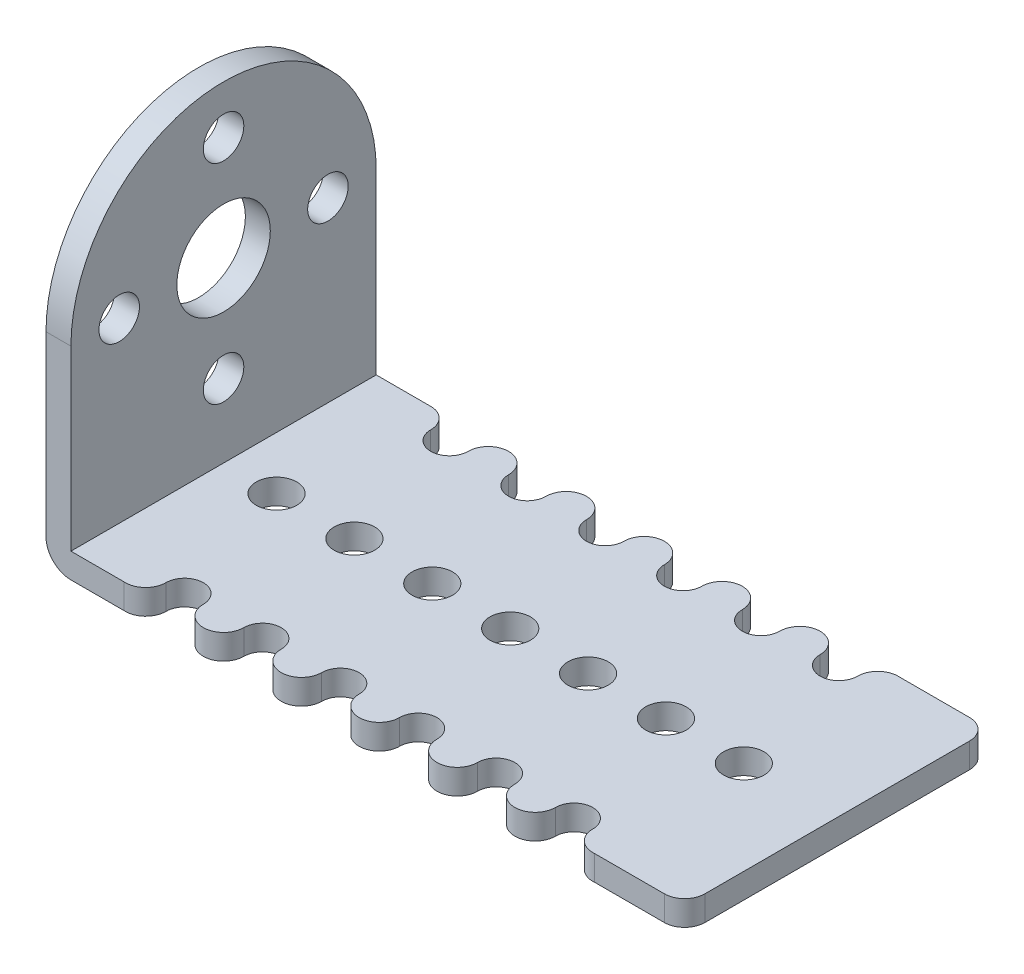
from build123d import *

# Parameters (mm, degrees)
BOSS_EXTRUDE1_DEPTH      = 2.032
SKETCH2_W                = 24.892
SKETCH2_H                = 2.032
BOSS_EXTRUDE2_DEPTH      = 7.366000072
SKETCH3_W                = 24.892
SKETCH3_H                = 2.032
BOSS_EXTRUDE3_DEPTH      = 4.318000079
BOSS_EXTRUDE4_DEPTH      = 2.032
M7_CLEARANCE_HOLE1_D     = 7.62
M3_CLEARANCE_HOLE1_D     = 3.302
M3_CLEARANCE_HOLE2_D     = 3.302
M3_CLEARANCE_HOLE2_DEPTH = 28.956
FILLET1_R                = 1.655535703
FILLET2_R                = 2.032


with BuildPart() as part:
    # Sketch1 → Boss-Extrude1 (new body)
    with BuildSketch(Plane.XZ):
        with BuildLine():
            Line((44.703999934, -12.446), (44.703999934, 12.446))
            ThreePointArc((44.703999934, 12.446), (43.455024595, 12.008165774), (42.926000003, 10.795000003))
            ThreePointArc((42.926000003, 10.795000003), (41.402000003, 9.271000003), (39.878000003, 10.795000003))
            ThreePointArc((39.878000003, 10.795000003), (38.227000003, 12.446000003), (36.576000003, 10.795000003))
            ThreePointArc((36.576000003, 10.795000003), (35.052000003, 9.271000003), (33.528000003, 10.795000003))
            ThreePointArc((33.528000003, 10.795000003), (31.877000003, 12.446000003), (30.226000003, 10.795000003))
            ThreePointArc((30.226000003, 10.795000003), (28.702000003, 9.271000003), (27.178000003, 10.795000003))
            ThreePointArc((27.178000003, 10.795000003), (25.527000003, 12.446000003), (23.876000003, 10.795000003))
            ThreePointArc((23.876000003, 10.795000003), (22.352000003, 9.271000003), (20.828000003, 10.795000003))
            ThreePointArc((20.828000003, 10.795000003), (19.177000003, 12.446000003), (17.526000003, 10.795000003))
            ThreePointArc((17.526000003, 10.795000003), (16.002000003, 9.271000003), (14.478000003, 10.795000003))
            ThreePointArc((14.478000003, 10.795000003), (12.827000003, 12.446000003), (11.176000003, 10.795000003))
            ThreePointArc((11.176000003, 10.795000003), (9.652000003, 9.271000003), (8.128000003, 10.795000003))
            ThreePointArc((8.128000003, 10.795000003), (7.598975413, 12.008165771), (6.350000079, 12.446))
            Line((6.350000079, 12.446), (6.350000079, -12.446))
            ThreePointArc((6.350000079, -12.446), (7.598975413, -12.008165771), (8.128000003, -10.795000003))
            ThreePointArc((8.128000003, -10.795000003), (9.652000003, -9.271000003), (11.176000003, -10.795000003))
            ThreePointArc((11.176000003, -10.795000003), (12.827000003, -12.446000003), (14.478000003, -10.795000003))
            ThreePointArc((14.478000003, -10.795000003), (16.002000003, -9.271000003), (17.526000003, -10.795000003))
            ThreePointArc((17.526000003, -10.795000003), (19.177000003, -12.446000003), (20.828000003, -10.795000003))
            ThreePointArc((20.828000003, -10.795000003), (22.352000003, -9.271000003), (23.876000003, -10.795000003))
            ThreePointArc((23.876000003, -10.795000003), (25.527000003, -12.446000003), (27.178000003, -10.795000003))
            ThreePointArc((27.178000003, -10.795000003), (28.702000003, -9.271000003), (30.226000003, -10.795000003))
            ThreePointArc((30.226000003, -10.795000003), (31.877000003, -12.446000003), (33.528000003, -10.795000003))
            ThreePointArc((33.528000003, -10.795000003), (35.052000003, -9.271000003), (36.576000003, -10.795000003))
            ThreePointArc((36.576000003, -10.795000003), (38.227000003, -12.446000003), (39.878000003, -10.795000003))
            ThreePointArc((39.878000003, -10.795000003), (41.402000003, -9.271000003), (42.926000003, -10.795000003))
            ThreePointArc((42.926000003, -10.795000003), (43.455024595, -12.008165773), (44.703999934, -12.446))
        make_face()
    extrude(amount=-BOSS_EXTRUDE1_DEPTH)

    # Sketch2 → Boss-Extrude2 (add)
    with BuildSketch(Plane(origin=(44.703999934, 0, 0), x_dir=(0, 0, -1), z_dir=(1, 0, 0))):
        with Locations((0, 1.016)):
            Rectangle(SKETCH2_W, SKETCH2_H)
    extrude(amount=BOSS_EXTRUDE2_DEPTH)

    # Sketch3 → Boss-Extrude3 (add)
    with BuildSketch(Plane.ZY.offset(-6.350000079)):
        with Locations((0, 1.016)):
            Rectangle(SKETCH3_W, SKETCH3_H)
    extrude(amount=BOSS_EXTRUDE3_DEPTH)

    # Sketch4 → Boss-Extrude4 (add)
    with BuildSketch(Plane.ZY.offset(-2.032)):
        with BuildLine():
            Line((-12.446, 0), (-12.446, 16.51))
            ThreePointArc((-12.446, 16.51), (0, 28.956), (12.446, 16.51))
            Line((12.446, 16.51), (12.446, 0))
            Line((12.446, 0), (-12.446, 0))
        make_face()
    extrude(amount=BOSS_EXTRUDE4_DEPTH)

    # M7 Clearance Hole1 (through all)
    with Locations(Plane(origin=(2.032, 0, 0), x_dir=(0, 0, -1), z_dir=(1, 0, 0))):
        with Locations((0, 16.51)):
            Hole(M7_CLEARANCE_HOLE1_D / 2)

    # M3 Clearance Hole1 (through all)
    with Locations(Plane(origin=(2.032, 0, 0), x_dir=(0, 0, -1), z_dir=(1, 0, 0))):
        with Locations((0, 25.019), (0, 8.001), (-8.509, 16.51), (8.509, 16.51)):
            Hole(M3_CLEARANCE_HOLE1_D / 2)

    # M3 Clearance Hole2
    with Locations(Plane(origin=(0, 0, 0), x_dir=(-1, 0, 0), z_dir=(0, -1, 0))):
        with Locations((-38.1, 0), (-25.4, 0), (-12.7, 0), (-6.35, 0), (-19.05, 0), (-31.75, 0), (-44.45, 0)):
            Hole(M3_CLEARANCE_HOLE2_D / 2, depth=M3_CLEARANCE_HOLE2_DEPTH)

    # Fillet1
    fillet1_edges = [part.edges().sort_by_distance(p)[0] for p in [
        (52.070000006, 1.016, -12.446),
        (52.070000006, 1.016, 12.446),
    ]]
    fillet(fillet1_edges, radius=FILLET1_R)

    # Fillet2
    fillet2_edges = [part.edges().sort_by_distance(p)[0] for p in [
        (0, 0, 0),
    ]]
    fillet(fillet2_edges, radius=FILLET2_R)


solid = part.part
